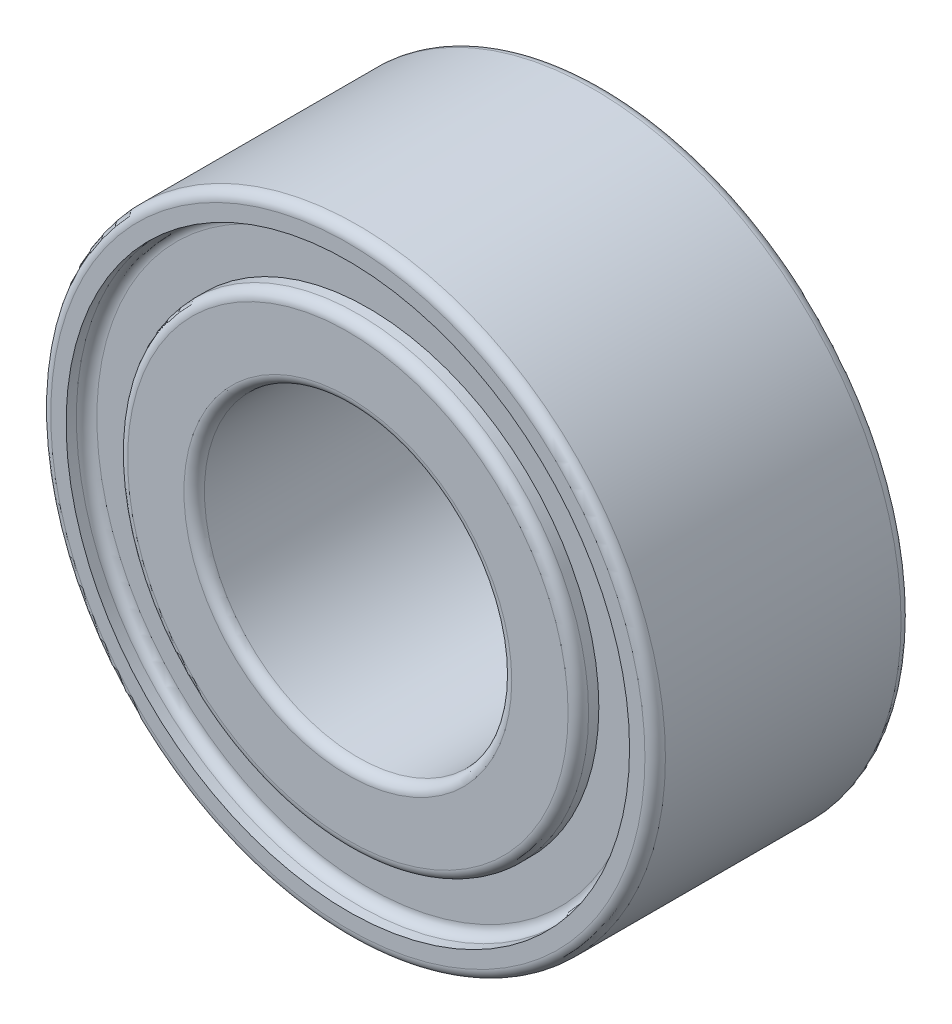
from build123d import *

# Parameters (mm, degrees)
SKETCH_1_R          = 3
SKETCH_1_R_2        = 1.5
EXTRUDE_1_DEPTH     = 2.5
SKETCH_2_R          = 2.75
SKETCH_2_R_2        = 2.25
CUT_EXTRUDE_1_DEPTH = 0.2
CUT_EXTRUDE_START   = -2.3
SKETCH_2_3_R        = 2.75
SKETCH_2_3_R_2      = 2.25
CUT_EXTRUDE_2_DEPTH = 0.2
FILLET_1_R          = 0.1


with BuildPart() as part:
    # 草图1 → 凸台-拉伸1 (new body)
    with BuildSketch(Plane.XY):
        Circle(SKETCH_1_R)
        Circle(SKETCH_1_R_2, mode=Mode.SUBTRACT)
    extrude(amount=EXTRUDE_1_DEPTH)

    # 草图2 → 切除-拉伸1 (cut)
    with BuildSketch(Plane.XY.offset(2.5)):
        Circle(SKETCH_2_R)
        Circle(SKETCH_2_R_2, mode=Mode.SUBTRACT)
    extrude(amount=-CUT_EXTRUDE_1_DEPTH, mode=Mode.SUBTRACT)

    # 草图2<3> → 切除-拉伸2 (cut)
    with BuildSketch(Plane.XY.offset(2.5).offset(CUT_EXTRUDE_START)):
        Circle(SKETCH_2_3_R)
        Circle(SKETCH_2_3_R_2, mode=Mode.SUBTRACT)
    extrude(amount=-CUT_EXTRUDE_2_DEPTH, mode=Mode.SUBTRACT)

    # 圆角1
    fillet_1_edges = [part.edges().sort_by_distance(p)[0] for p in [
        (-1.5, 0, 0),
        (-2.25, 0, 0),
        (-2.75, 0, 0),
        (-3, 0, 0),
        (-3, 0, 2.5),
        (-2.75, 0, 2.3),
        (-2.25, 0, 2.5),
        (-1.5, 0, 2.5),
    ]]
    fillet(fillet_1_edges, radius=FILLET_1_R)


solid = part.part
